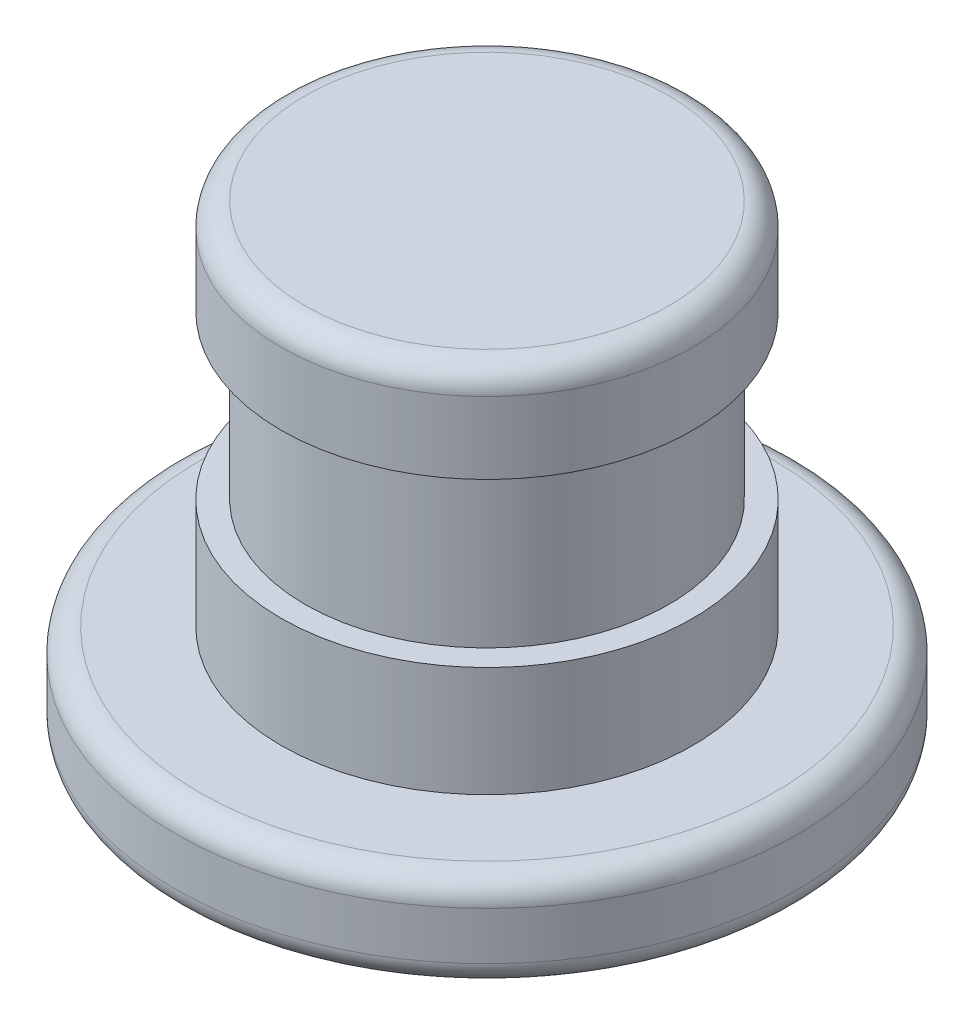
from build123d import *

# Parameters (mm, degrees)
ESBO_O1_R                = 6.5
RESSALTO_EXTRUS_O1_DEPTH = 2
ESBO_O2_R                = 4.3
RESSALTO_EXTRUS_O2_DEPTH = 2.3
ESBO_O3_R                = 3.8
RESSALTO_EXTRUS_O3_DEPTH = 3.4
ESBO_O4_R                = 4.3
RESSALTO_EXTRUS_O4_DEPTH = 2
FILETE1_R                = 0.5


with BuildPart() as part:
    # Esboço1 → Ressalto-extrusão1 (new body)
    with BuildSketch(Plane(origin=(0, 0, 0), x_dir=(1, 0, 0), z_dir=(0, 1, 0))):
        with Locations(Location((0, 0, 0), (0, 0, 270))):
            Circle(ESBO_O1_R)
    extrude(amount=-RESSALTO_EXTRUS_O1_DEPTH)

    # Esboço2 → Ressalto-extrusão2 (add)
    with BuildSketch(Plane(origin=(0, 0, 0), x_dir=(1, 0, 0), z_dir=(0, 1, 0))):
        with Locations(Location((0, 0, 0), (0, 0, 270))):
            Circle(ESBO_O2_R)
    extrude(amount=RESSALTO_EXTRUS_O2_DEPTH)

    # Esboço3 → Ressalto-extrusão3 (add)
    with BuildSketch(Plane(origin=(0, 2.3, 0), x_dir=(1, 0, 0), z_dir=(0, 1, 0))):
        with Locations(Location((0, 0, 0), (0, 0, 270))):
            Circle(ESBO_O3_R)
    extrude(amount=RESSALTO_EXTRUS_O3_DEPTH)

    # Esboço4 → Ressalto-extrusão4 (add)
    with BuildSketch(Plane(origin=(0, 5.7, 0), x_dir=(1, 0, 0), z_dir=(0, 1, 0))):
        with Locations(Location((0, 0, 0), (0, 0, 270))):
            Circle(ESBO_O4_R)
    extrude(amount=RESSALTO_EXTRUS_O4_DEPTH)

    # Filete1
    filete1_edges = [part.edges().sort_by_distance(p)[0] for p in [
        (0, 7.7, -4.3),
        (0, 0, -6.5),
        (0, -2, -6.5),
    ]]
    fillet(filete1_edges, radius=FILETE1_R)


solid = part.part
